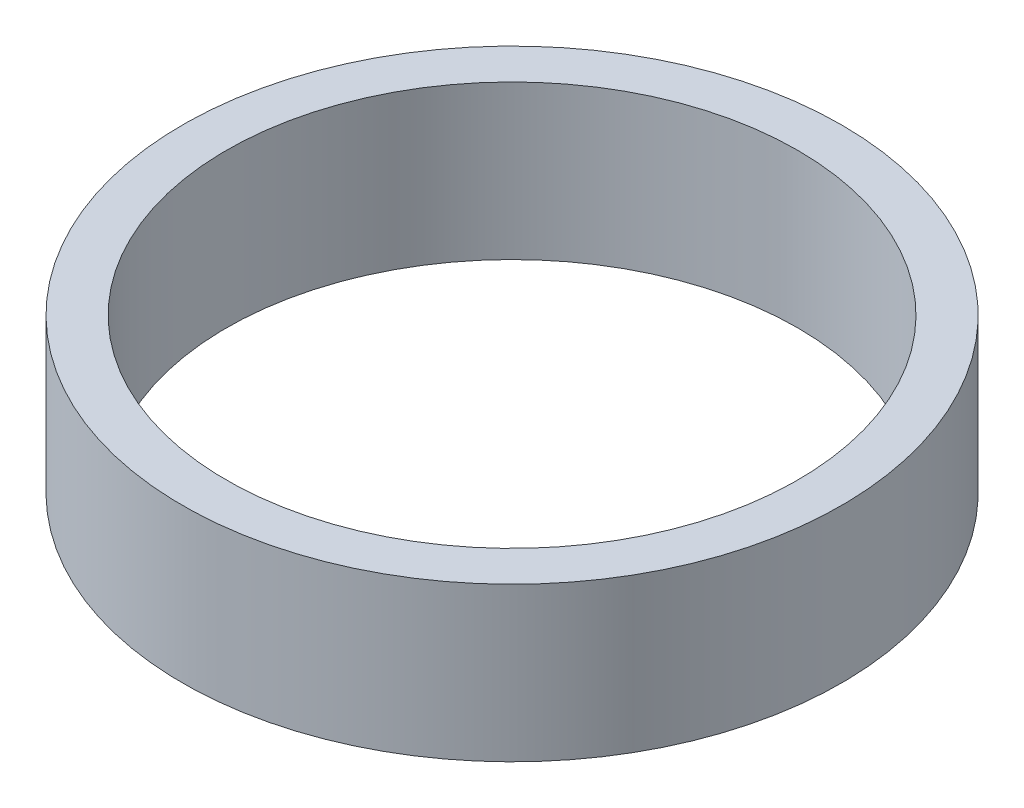
from build123d import *

# Parameters (mm, degrees)
ESQUISSE1_W = 1
ESQUISSE1_H = 3.5


with BuildPart() as part:
    # Esquisse1 → Base (revolve)
    with BuildSketch(Plane.XY):
        with Locations((7, 1.75)):
            Rectangle(ESQUISSE1_W, ESQUISSE1_H)
    revolve(axis=Axis((0, 0, 0), (0, 1, 0)))


solid = part.part
